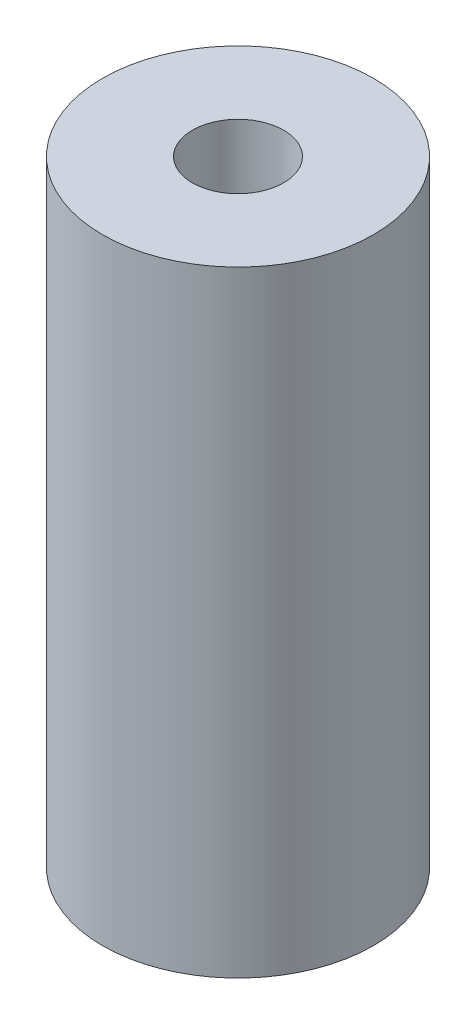
from build123d import *

# Parameters (mm, degrees)
SKETCH1_R           = 23.749
SKETCH1_R_2         = 8.001
BOSS_EXTRUDE1_DEPTH = 107.95


with BuildPart() as part:
    # Sketch1 → Boss-Extrude1 (new body)
    with BuildSketch(Plane(origin=(0, 0, 0), x_dir=(1, 0, 0), z_dir=(0, 1, 0))):
        with Locations(Location((0, 0, 0), (0, 0, 270))):
            Circle(SKETCH1_R)
        with Locations(Location((0, 0, 0), (0, 0, 270))):
            Circle(SKETCH1_R_2, mode=Mode.SUBTRACT)
    extrude(amount=BOSS_EXTRUDE1_DEPTH)


solid = part.part
